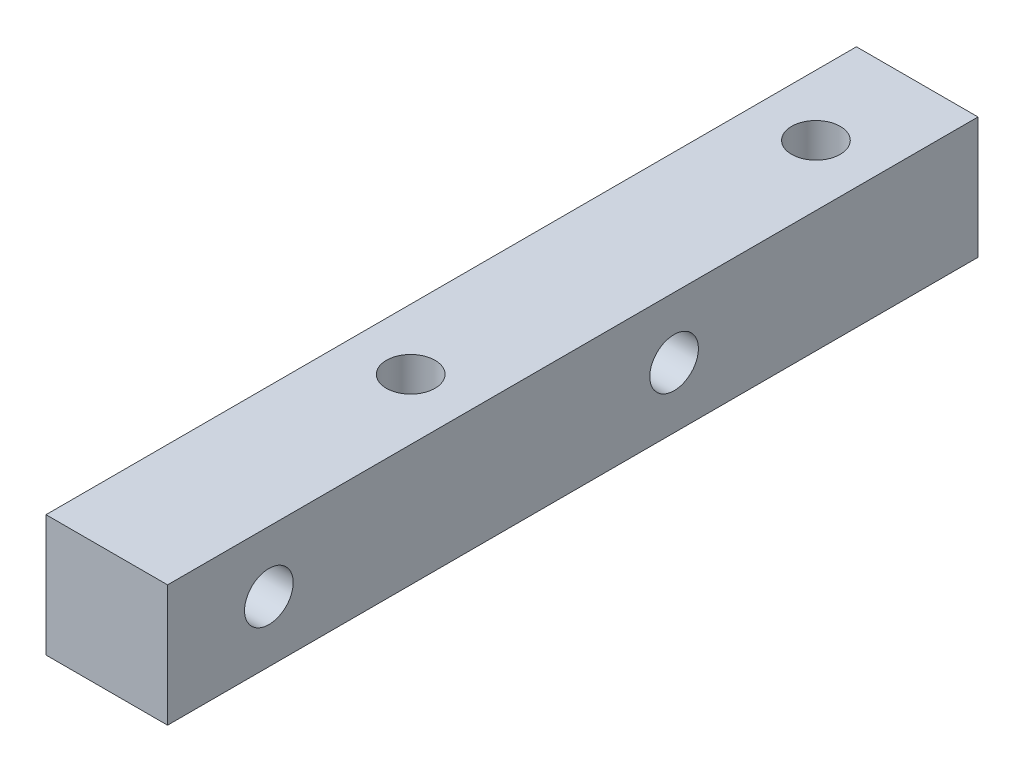
from build123d import *

# Parameters (mm, degrees)
SKETCH_1_W              = 6
SKETCH_1_H              = 40
EXTRUDE_1_DEPTH         = 6
HOLE_WIZARD_2_4_2_4_1_D = 2.4
HOLE_WIZARD_2_4_2_4_2_D = 2.4


with BuildPart() as part:
    # 草图1 → 凸台-拉伸1 (new body)
    with BuildSketch(Plane(origin=(0, 0, 0), x_dir=(0, -1, 0), z_dir=(-1, 0, 0))):
        with Locations((-3, 20)):
            Rectangle(SKETCH_1_W, SKETCH_1_H)
    extrude(amount=-EXTRUDE_1_DEPTH)

    # Ø2.4 (2.4) 直径孔1 (through all)
    with Locations(Plane(origin=(0, 6, 0), x_dir=(1, 0, 0), z_dir=(0, 1, 0))):
        with Locations((3, -5), (3, -25)):
            Hole(HOLE_WIZARD_2_4_2_4_1_D / 2)

    # Ø2.4 (2.4) 直径孔2 (through all)
    with Locations(Plane.ZY):
        with Locations((35, 3), (15, 3)):
            Hole(HOLE_WIZARD_2_4_2_4_2_D / 2)


solid = part.part
